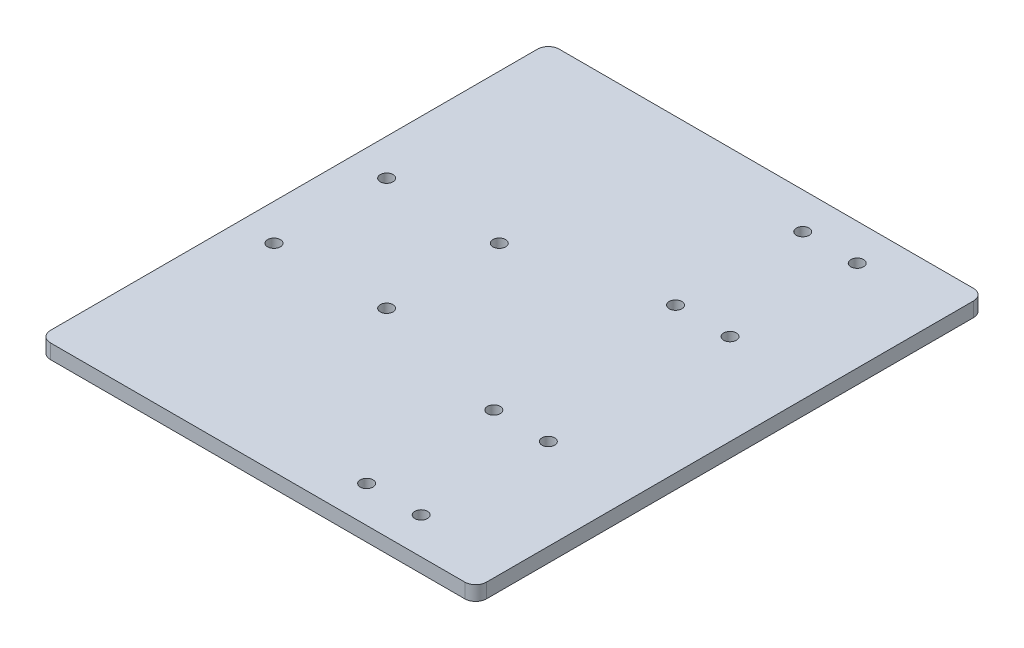
from build123d import *

# Parameters (mm, degrees)
SKETCH1_W           = 120
SKETCH1_H           = 140
SKETCH1_R           = 1.75
BOSS_EXTRUDE1_DEPTH = 4
FILLET1_R           = 3


with BuildPart() as part:
    # Sketch1 → Boss-Extrude1 (new body)
    with BuildSketch(Plane(origin=(0, 0, 0), x_dir=(1, 0, 0), z_dir=(0, 1, 0))):
        Rectangle(SKETCH1_W, SKETCH1_H)
        with Locations(Location((-50, 15.5, 0), (0, 0, 270))):
            Circle(SKETCH1_R, mode=Mode.SUBTRACT)
        with Locations(Location((-19, 15.5, 0), (0, 0, 270))):
            Circle(SKETCH1_R, mode=Mode.SUBTRACT)
        with Locations(Location((-50, -15.5, 0), (0, 0, 270))):
            Circle(SKETCH1_R, mode=Mode.SUBTRACT)
        with Locations(Location((-19, -15.5, 0), (0, 0, 270))):
            Circle(SKETCH1_R, mode=Mode.SUBTRACT)
        with Locations(Location((20, 60, 0), (0, 0, 270))):
            Circle(SKETCH1_R, mode=Mode.SUBTRACT)
        with Locations(Location((35, 60, 0), (0, 0, 270))):
            Circle(SKETCH1_R, mode=Mode.SUBTRACT)
        with Locations(Location((35, 25, 0), (0, 0, 270))):
            Circle(SKETCH1_R, mode=Mode.SUBTRACT)
        with Locations(Location((20, 25, 0), (0, 0, 270))):
            Circle(SKETCH1_R, mode=Mode.SUBTRACT)
        with Locations(Location((20, -60, 0), (0, 0, 270))):
            Circle(SKETCH1_R, mode=Mode.SUBTRACT)
        with Locations(Location((35, -60, 0), (0, 0, 270))):
            Circle(SKETCH1_R, mode=Mode.SUBTRACT)
        with Locations(Location((35, -25, 0), (0, 0, 270))):
            Circle(SKETCH1_R, mode=Mode.SUBTRACT)
        with Locations(Location((20, -25, 0), (0, 0, 270))):
            Circle(SKETCH1_R, mode=Mode.SUBTRACT)
    extrude(amount=BOSS_EXTRUDE1_DEPTH)

    # Fillet1
    fillet1_edges = [part.edges().sort_by_distance(p)[0] for p in [
        (60, 2, 70),
        (-60, 2, 70),
        (-60, 2, -70),
        (60, 2, -70),
    ]]
    fillet(fillet1_edges, radius=FILLET1_R)


solid = part.part
